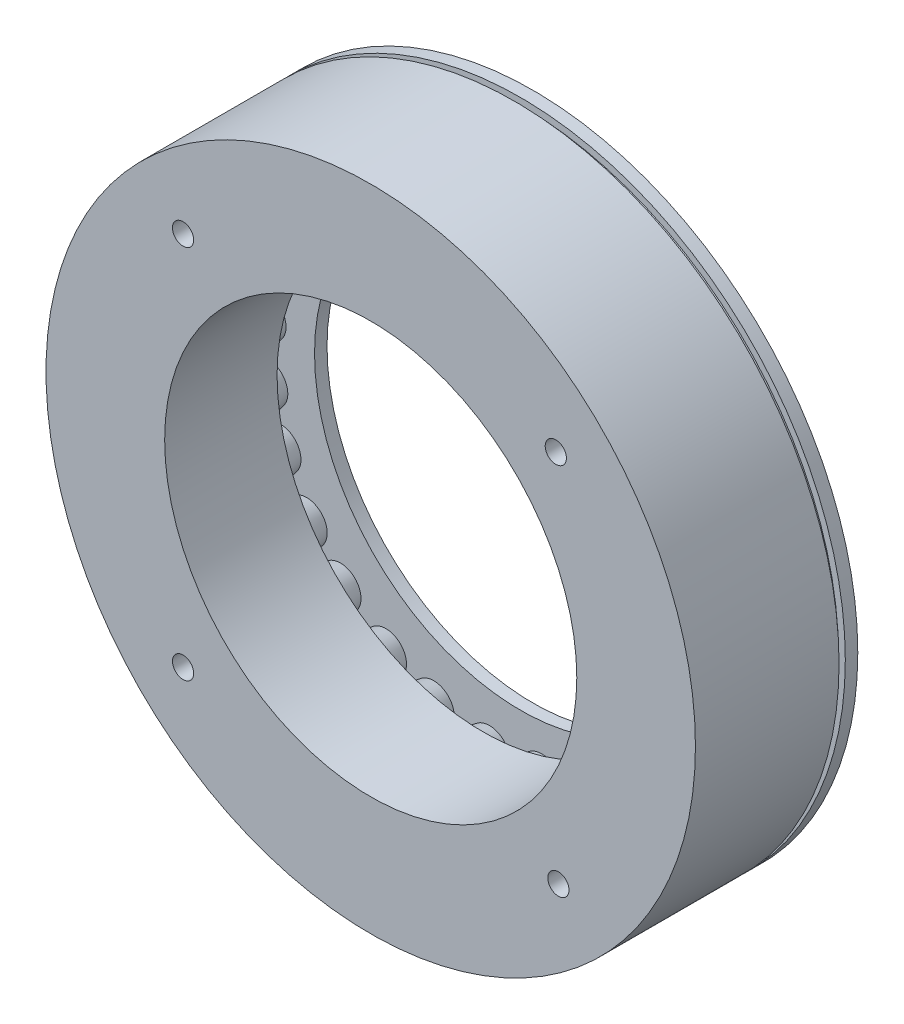
from build123d import *

# Parameters (mm, degrees)
CROQUIS1_R                       = 52
CROQUIS1_R_2                     = 33
SALIENTE_EXTRUIR1_DEPTH          = 26
CROQUIS7_R                       = 4
SALIENTE_EXTRUIR3_DEPTH          = 4
SALIENTE_EXTRUIR3_TAPER          = 10
CROQUIS8_W                       = 13.53009604
CROQUIS8_H                       = 1
TALADRO_DE_MARGEN_PARA_M31_D     = 3.4
TALADRO_DE_MARGEN_PARA_M31_DEPTH = 8.978536948
TALADRO_DE_MARGEN_PARA_M31_TIP   = 1.021463052


with BuildPart() as part:
    # Croquis1 → Saliente-Extruir1 (new body)
    with BuildSketch(Plane.XY):
        Circle(CROQUIS1_R)
        Circle(CROQUIS1_R_2, mode=Mode.SUBTRACT)
    extrude(amount=-SALIENTE_EXTRUIR1_DEPTH)

    # Croquis3 → Cortar-Revolución5 (revolve, cut)
    with BuildSketch(Plane(origin=(0, 0, 0), x_dir=(1, 0, 0), z_dir=(0, 1, 0)), mode=Mode.PRIVATE) as cortar_revoluci_n5_sk:
        Polygon((-24.867655095, 24), (-24.867655095, 18), (-42.182287996, 18), (-50, 18), (-50, 24), align=None)
    revolve(cortar_revoluci_n5_sk.sketch.rotate(Axis((0, 0, -34.839957344), (0, 0, 1)), 180), axis=Axis((0, 0, -34.839957344), (0, 0, 1)), mode=Mode.SUBTRACT)

    # Croquis7 → Saliente-Extruir3 (add)
    with BuildSketch(Plane(origin=(0, 0, -18), x_dir=(-1, 0, 0), z_dir=(0, 0, -1))):
        with Locations((-36.46504052, 13.83115396)):
            Circle(CROQUIS7_R)
        with Locations((-40.901204036, 21.049738915)):
            Circle(CROQUIS7_R)
        with Locations((-32.264823395, 21.908472592)):
            Circle(CROQUIS7_R)
        with Locations((-26.852753479, 28.283027253)):
            Circle(CROQUIS7_R)
        with Locations((-35.406439285, 29.366376303)):
            Circle(CROQUIS7_R)
        with Locations((-45.983850924, 1.218792098)):
            Circle(CROQUIS7_R)
        with Locations((-45.035111334, -9.372232773)):
            Circle(CROQUIS7_R)
        with Locations((-37.245521951, -11.565945471)):
            Circle(CROQUIS7_R)
        with Locations((-41.958832182, -18.853551441)):
            Circle(CROQUIS7_R)
        with Locations((-36.508773875, -27.984092448)):
            Circle(CROQUIS7_R)
        with Locations((-33.549212494, -19.885933246)):
            Circle(CROQUIS7_R)
        with Locations((-28.538780079, -26.580783126)):
            Circle(CROQUIS7_R)
        with Locations((-29.623352135, -35.191717894)):
            Circle(CROQUIS7_R)
        with Locations((-21.598612927, -32.473064525)):
            Circle(CROQUIS7_R)
        with Locations((-20.751425999, -41.053359412)):
            Circle(CROQUIS7_R)
        with Locations((-14.179582807, -36.330970692)):
            Circle(CROQUIS7_R)
        with Locations((-11.42060389, -44.55973302)):
            Circle(CROQUIS7_R)
        with Locations((-5.37014318, -38.628507119)):
            Circle(CROQUIS7_R)
        with Locations((-0.884003705, -45.991505057)):
            Circle(CROQUIS7_R)
        with Locations((2.98805474, -38.885363942)):
            Circle(CROQUIS7_R)
        with Locations((9.044135019, -45.102146532)):
            Circle(CROQUIS7_R)
        with Locations((11.921949284, -37.13310013)):
            Circle(CROQUIS7_R)
        with Locations((19.158506365, -41.820469078)):
            Circle(CROQUIS7_R)
        with Locations((27.717572068, -36.711526782)):
            Circle(CROQUIS7_R)
        with Locations((26.852753479, -28.283027253)):
            Circle(CROQUIS7_R)
        with Locations((40.901204036, -21.049738915)):
            Circle(CROQUIS7_R)
        with Locations((32.264823395, -21.908472592)):
            Circle(CROQUIS7_R)
        with Locations((36.46504052, -13.83115396)):
            Circle(CROQUIS7_R)
        with Locations((44.641692674, -11.095912546)):
            Circle(CROQUIS7_R)
        with Locations((35.406439285, -29.366376303)):
            Circle(CROQUIS7_R)
        with Locations((38.575331413, -5.739669532)):
            Circle(CROQUIS7_R)
        with Locations((45.983850924, -1.218792098)):
            Circle(CROQUIS7_R)
        with Locations((38.854979072, 3.360149003)):
            Circle(CROQUIS7_R)
        with Locations((45.035111334, 9.372232773)):
            Circle(CROQUIS7_R)
        with Locations((37.245521951, 11.565945471)):
            Circle(CROQUIS7_R)
        with Locations((41.958832182, 18.853551441)):
            Circle(CROQUIS7_R)
        with Locations((33.549212494, 19.885933246)):
            Circle(CROQUIS7_R)
        with Locations((36.508773875, 27.984092448)):
            Circle(CROQUIS7_R)
        with Locations((28.538780079, 26.580783126)):
            Circle(CROQUIS7_R)
        with Locations((29.623352135, 35.191717894)):
            Circle(CROQUIS7_R)
        with Locations((21.598612927, 32.473064525)):
            Circle(CROQUIS7_R)
        with Locations((20.751425999, 41.053359412)):
            Circle(CROQUIS7_R)
        with Locations((14.179582807, 36.330970692)):
            Circle(CROQUIS7_R)
        with Locations((11.42060389, 44.55973302)):
            Circle(CROQUIS7_R)
        with Locations((5.37014318, 38.628507119)):
            Circle(CROQUIS7_R)
        with Locations((0.884003705, 45.991505057)):
            Circle(CROQUIS7_R)
        with Locations((-9.044135019, 45.102146532)):
            Circle(CROQUIS7_R)
        with Locations((-2.98805474, 38.885363942)):
            Circle(CROQUIS7_R)
        with Locations((-11.921949284, 37.13310013)):
            Circle(CROQUIS7_R)
        with Locations((-19.158506365, 41.820469078)):
            Circle(CROQUIS7_R)
        with Locations((-27.717572068, 36.711526782)):
            Circle(CROQUIS7_R)
        with Locations((-19.5638714, 33.738033965)):
            Circle(CROQUIS7_R)
        with Locations((-38.575331413, 5.739669532)):
            Circle(CROQUIS7_R)
        with Locations((-44.641692674, 11.095912546)):
            Circle(CROQUIS7_R)
        with Locations((-38.854979072, -3.360149003)):
            Circle(CROQUIS7_R)
        with Locations((19.5638714, -33.738033965)):
            Circle(CROQUIS7_R)
    extrude(amount=SALIENTE_EXTRUIR3_DEPTH, taper=SALIENTE_EXTRUIR3_TAPER)

    # Croquis8 → Cortar-Revolución6 (revolve, cut)
    with BuildSketch(Plane(origin=(0, 0, 0), x_dir=(1, 0, 0), z_dir=(0, 1, 0)), mode=Mode.PRIVATE) as cortar_revoluci_n6_sk:
        with Locations((-57.687957666, 23.5)):
            Rectangle(CROQUIS8_W, CROQUIS8_H)
    revolve(cortar_revoluci_n6_sk.sketch.rotate(Axis((0, 0, -34.839957344), (0, 0, 1)), 180), axis=Axis((0, 0, -34.839957344), (0, 0, 1)), mode=Mode.SUBTRACT)

    # Taladro de margen para M31
    with Locations(Plane(origin=(-30.0520382, -30.0520382, 0), x_dir=(1, 0, 0), z_dir=(0, 0, 1))):
        with Locations((0, 0), (60.1040764, 0), (59.691657064, 59.691657064), (0, 60.1040764)):
            Hole(TALADRO_DE_MARGEN_PARA_M31_D / 2, depth=TALADRO_DE_MARGEN_PARA_M31_DEPTH)
            with Locations((0, 0, -(TALADRO_DE_MARGEN_PARA_M31_DEPTH + TALADRO_DE_MARGEN_PARA_M31_TIP / 2))):  # 118° drill point
                Cone(0, TALADRO_DE_MARGEN_PARA_M31_D / 2, TALADRO_DE_MARGEN_PARA_M31_TIP, mode=Mode.SUBTRACT)


solid = part.part
